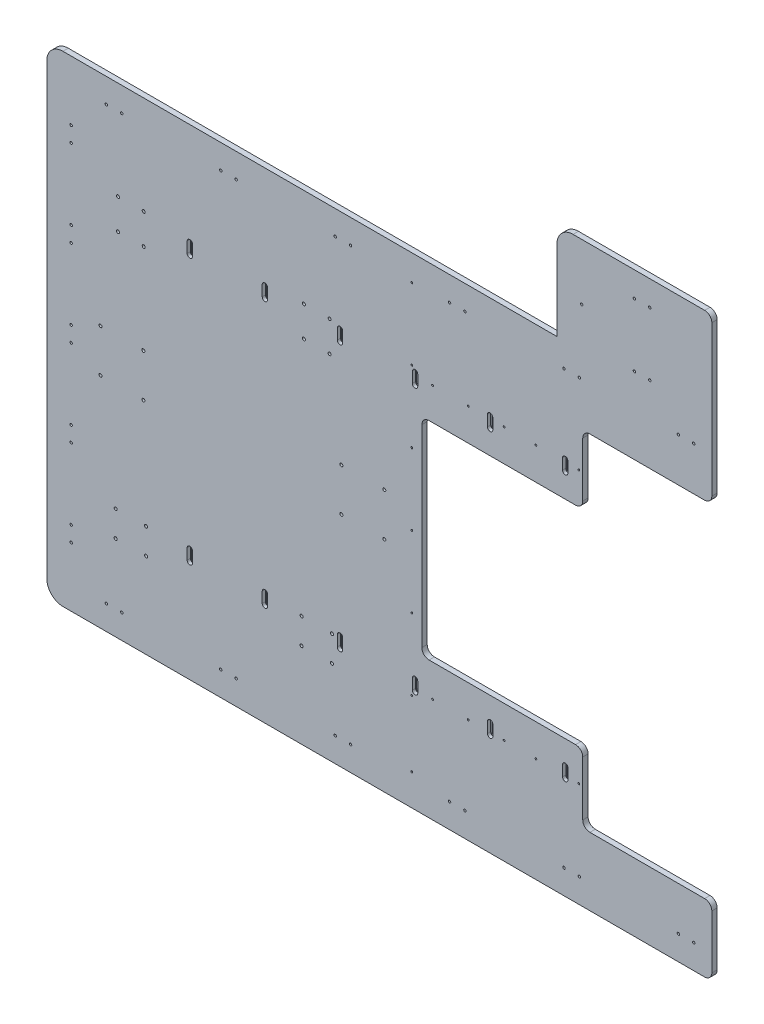
from build123d import *

# Parameters (mm, degrees)
SKETCH_1_W             = 1499
SKETCH_1_H             = 1345
EXTRUDE_1_DEPTH        = 7.5
EXTRUDE_START          = -15
SKETCH_2_W             = 400
SKETCH_2_H             = 240
EXTRUDE_2_DEPTH        = 15
SKETCH_3_W             = 400
SKETCH_3_H             = 270
EXTRUDE_3_DEPTH        = 15
SKETCH_4_W             = 100
SKETCH_4_H             = 270
CUT_EXTRUDE_1_DEPTH    = 20
SKETCH_5_W             = 39
SKETCH_5_H             = 1615
CUT_EXTRUDE_2_DEPTH    = 20
SKETCH_6_W             = 361
SKETCH_6_H             = 50
CUT_EXTRUDE_3_DEPTH    = 20
SKETCH_7_W             = 450
SKETCH_7_H             = 580
CUT_EXTRUDE_4_DEPTH    = 20
FILLET_1_R             = 20
CUT_EXTRUDE_5_DEPTH    = 20
CUT_EXTRUDE_START      = -15
CUT_EXTRUDE_7_DEPTH    = 9
PATTERN_LINEAR_2_COUNT = 6
PATTERN_LINEAR_2_PITCH = 210
SKETCH_12_W            = 172
SKETCH_12_H            = 270
EXTRUDE_4_DEPTH        = 15
FILLET_2_R             = 45
FILLET_3_R             = 45
HOLE_WIZARD_M6_1_D     = 5
HOLE_WIZARD_M6_2_D     = 5
PATTERN_LINEAR_3_COUNT = 6
PATTERN_LINEAR_3_PITCH = 200
HOLE_WIZARD_M6_3_D     = 5
FILLET_4_R             = 20
HOLE_WIZARD_M8_1_D     = 6.8
PATTERN_LINEAR_4_COUNT = 5
PATTERN_LINEAR_4_PITCH = 242
HOLE_WIZARD_M8_2_D     = 6.8
PATTERN_LINEAR_5_COUNT = 6
PATTERN_LINEAR_5_PITCH = 320
HOLE_WIZARD_M8_3_D     = 6.8
HOLE_WIZARD_M8_4_D     = 6.8
HOLE_WIZARD_M10_1_D    = 8.5
HOLE_WIZARD_M10_2_D    = 8.5


with BuildPart() as part:
    # 草图1 → 凸台-拉伸1 (new, symmetric)
    with BuildSketch(Plane.XY):
        Rectangle(SKETCH_1_W, SKETCH_1_H)
    extrude(amount=EXTRUDE_1_DEPTH, both=True)

    # 草图2 → 凸台-拉伸2 (add)
    with BuildSketch(Plane.XY.offset(7.5).offset(EXTRUDE_START)):
        with Locations((949.5, 552.5)):
            Rectangle(SKETCH_2_W, SKETCH_2_H)
        with Locations((949.5, -552.5)):
            Rectangle(SKETCH_2_W, SKETCH_2_H)
    extrude(amount=EXTRUDE_2_DEPTH)

    # 草图3 → 凸台-拉伸3 (add)
    with BuildSketch(Plane.XY.offset(7.5).offset(EXTRUDE_START)):
        with Locations((949.5, 807.5)):
            Rectangle(SKETCH_3_W, SKETCH_3_H)
    extrude(amount=EXTRUDE_3_DEPTH)

    # 草图4 → 切除-拉伸1 (cut)
    with BuildSketch(Plane.XY.offset(7.5)):
        with Locations((799.5, 807.5)):
            Rectangle(SKETCH_4_W, SKETCH_4_H)
    extrude(amount=-CUT_EXTRUDE_1_DEPTH, mode=Mode.SUBTRACT)

    # 草图5 → 切除-拉伸2 (cut)
    with BuildSketch(Plane.XY.offset(7.5)):
        with Locations((1130, 135)):
            Rectangle(SKETCH_5_W, SKETCH_5_H)
    extrude(amount=-CUT_EXTRUDE_2_DEPTH, mode=Mode.SUBTRACT)

    # 草图6 → 切除-拉伸3 (cut)
    with BuildSketch(Plane.XY.offset(7.5)):
        with Locations((930, 457.5)):
            Rectangle(SKETCH_6_W, SKETCH_6_H)
        with Locations((930, -457.5)):
            Rectangle(SKETCH_6_W, SKETCH_6_H)
    extrude(amount=-CUT_EXTRUDE_3_DEPTH, mode=Mode.SUBTRACT)

    # 草图7 → 切除-拉伸4 (cut)
    with BuildSketch(Plane.XY.offset(7.5)):
        with Locations((524.5, 0)):
            Rectangle(SKETCH_7_W, SKETCH_7_H)
    extrude(amount=-CUT_EXTRUDE_4_DEPTH, mode=Mode.SUBTRACT)

    # 圆角1
    fillet_1_edges = [part.edges().sort_by_distance(p)[0] for p in [
        (1110.5, -482.5, 0),
        (1110.5, 482.5, 0),
        (749.5, 482.5, 0),
        (749.5, -482.5, 0),
        (749.5, 290, 0),
        (749.5, -290, 0),
        (299.5, -290, 0),
        (299.5, 290, 0),
    ]]
    fillet(fillet_1_edges, radius=FILLET_1_R)

    # 草图10 → 切除-拉伸5 (cut)
    with BuildSketch(Plane.XY.offset(7.5)):
        with BuildLine():
            Line((-354, 356.5), (-354, 386.5))
            ThreePointArc((-354, 386.5), (-349.5, 391), (-345, 386.5))
            Line((-345, 386.5), (-345, 356.5))
            ThreePointArc((-345, 356.5), (-349.5, 352), (-354, 356.5))
        make_face()
        with BuildLine():
            Line((-354, -386.5), (-354, -356.5))
            ThreePointArc((-354, -356.5), (-349.5, -352), (-345, -356.5))
            Line((-345, -356.5), (-345, -386.5))
            ThreePointArc((-345, -386.5), (-349.5, -391), (-354, -386.5))
        make_face()
    cut_extrude_5 = extrude(amount=-CUT_EXTRUDE_5_DEPTH, mode=Mode.SUBTRACT)

    # 草图11 → 切除-拉伸7 (cut)
    with BuildSketch(Plane(origin=(0, 0, -7.5), x_dir=(-1, 0, 0), z_dir=(0, 0, -1)).offset(CUT_EXTRUDE_START)):
        with BuildLine():
            Line((357, 386.5), (357, 356.5))
            ThreePointArc((357, 356.5), (349.5, 349), (342, 356.5))
            Line((342, 356.5), (342, 386.5))
            ThreePointArc((342, 386.5), (349.5, 394), (357, 386.5))
        make_face()
        with BuildLine():
            Line((357, -356.5), (357, -386.5))
            ThreePointArc((357, -386.5), (349.5, -394), (342, -386.5))
            Line((342, -386.5), (342, -356.5))
            ThreePointArc((342, -356.5), (349.5, -349), (357, -356.5))
        make_face()
    cut_extrude_7 = extrude(amount=CUT_EXTRUDE_7_DEPTH, mode=Mode.SUBTRACT)

    # 阵列(线性)2: 切除-拉伸5, 切除-拉伸7 ×6
    with Locations(*[(i * PATTERN_LINEAR_2_PITCH, 0, 0) for i in range(1, PATTERN_LINEAR_2_COUNT)]):
        add(cut_extrude_5, mode=Mode.SUBTRACT)
        add(cut_extrude_7, mode=Mode.SUBTRACT)

    # 草图12 → 凸台-拉伸4 (add)
    with BuildSketch(Plane(origin=(0, 0, -7.5), x_dir=(-1, 0, 0), z_dir=(0, 0, -1)).offset(EXTRUDE_START)):
        with Locations((-763.5, 807.5)):
            Rectangle(SKETCH_12_W, SKETCH_12_H)
    extrude(amount=EXTRUDE_4_DEPTH)

    # 圆角2
    fillet_2_edges = [part.edges().sort_by_distance(p)[0] for p in [
        (-749.5, 672.5, 0),
        (-749.5, -672.5, 0),
    ]]
    fillet(fillet_2_edges, radius=FILLET_2_R)

    # 圆角3
    fillet_3_edges = [part.edges().sort_by_distance(p)[0] for p in [
        (677.5, 942.5, 0),
    ]]
    fillet(fillet_3_edges, radius=FILLET_3_R)

    # M6 螺纹孔1 (through all)
    with Locations(Plane.XY.offset(7.5)):
        with Locations((329.5, 380), (429.5, 380), (529.5, 380), (618.5, 380), (329.5, -380), (429.5, -380), (529.5, -380), (618.5, -380), (738.5, -380), (738.5, 380)):
            Hole(HOLE_WIZARD_M6_1_D / 2)

    # M6 螺纹孔2 (through all)
    with Locations(Plane.XY.offset(7.5)):
        with Locations((271.500005274, 600.000006702)):
            hole_wizard_m6_2 = Hole(HOLE_WIZARD_M6_2_D / 2)

    # 阵列(线性)3: M6 螺纹孔2 ×6
    with Locations(*[(0, -i * PATTERN_LINEAR_3_PITCH, 0) for i in range(1, PATTERN_LINEAR_3_COUNT)]):
        add(hole_wizard_m6_2, mode=Mode.SUBTRACT)

    # M6 螺纹孔3 (through all)
    with Locations(Plane.XY.offset(7.5)):
        with Locations((271.500005274, -584.999993298)):
            Hole(HOLE_WIZARD_M6_3_D / 2)

    # 圆角4
    fillet_4_edges = [part.edges().sort_by_distance(p)[0] for p in [
        (1110.5, 942.5, 0),
        (1110.5, -672.5, 0),
    ]]
    fillet(fillet_4_edges, radius=FILLET_4_R)

    # M8 螺纹孔1 (through all)
    with Locations(Plane.XY.offset(7.5)):
        with Locations((-681.5, -463), (-681.5, -506)):
            hole_wizard_m8_1 = Hole(HOLE_WIZARD_M8_1_D / 2)

    # 阵列(线性)4: M8 螺纹孔1 ×5
    with Locations(*[(0, i * PATTERN_LINEAR_4_PITCH, 0) for i in range(1, PATTERN_LINEAR_4_COUNT)]):
        add(hole_wizard_m8_1, mode=Mode.SUBTRACT)

    # M8 螺纹孔2 (through all)
    with Locations(Plane.XY.offset(7.5)):
        with Locations((-582.999995648, 604.5), (-539.999995648, 604.5), (-582.999995648, -604.5), (-539.999995648, -604.5)):
            hole_wizard_m8_2 = Hole(HOLE_WIZARD_M8_2_D / 2)

    # 阵列(线性)5: M8 螺纹孔2 ×6
    with Locations(*[(i * PATTERN_LINEAR_5_PITCH, 0, 0) for i in range(1, PATTERN_LINEAR_5_COUNT)]):
        add(hole_wizard_m8_2, mode=Mode.SUBTRACT)

    # M8 螺纹孔3 (through all)
    with Locations(Plane.XY.offset(7.5)):
        with Locations((894.000004352, 872.5), (937.000004352, 872.5), (894.000004352, 696.5), (937.000004352, 696.5)):
            Hole(HOLE_WIZARD_M8_3_D / 2)

    # M8 螺纹孔4 (through all)
    with Locations(Plane.XY.offset(7.5)):
        with Locations((746.5, 785)):
            Hole(HOLE_WIZARD_M8_4_D / 2)

    # M10 螺纹孔1 (through all)
    with Locations(Plane.XY.offset(7.5)):
        with Locations((-550.5, 397.500006032), (-478.5, 397.500006032), (-478.5, 312.500006032), (-550.5, 312.500006032), (-30.5, 397.500006032), (41.5, 397.500006032), (-30.5, 312.500006032), (41.5, 312.500006032), (-557, -361.999993968), (-472, -361.999993968), (-557, -433.999993968), (-472, -433.999993968), (-37, -361.999993968), (48, -361.999993968), (-37, -433.999993968), (48, -433.999993968)):
            Hole(HOLE_WIZARD_M10_1_D / 2)

    # M10 螺纹孔2 (through all)
    with Locations(Plane.XY.offset(7.5)):
        with Locations((-599.5, 60), (-479.5, 60), (-599.5, -60), (-479.5, -60), (74.5, 60), (194.5, 60), (74.5, -60), (194.5, -60)):
            Hole(HOLE_WIZARD_M10_2_D / 2)


solid = part.part
